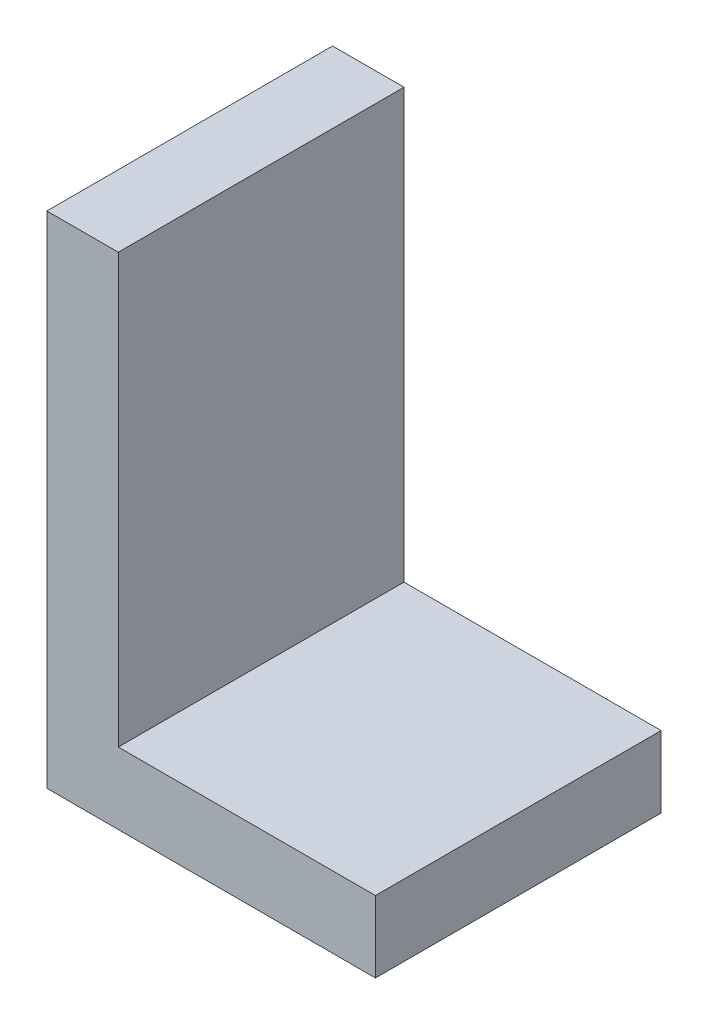
from build123d import *

# Parameters (mm, degrees)
RESSALTO_EXTRUS_O1_DEPTH = 400


with BuildPart() as part:
    # Esboço1 → Ressalto-extrusão1 (new body)
    with BuildSketch(Plane.XY):
        Polygon((0, 0), (0, 700), (100, 700), (100, 100), (460, 100), (460, 0), align=None)
    extrude(amount=RESSALTO_EXTRUS_O1_DEPTH)


solid = part.part
